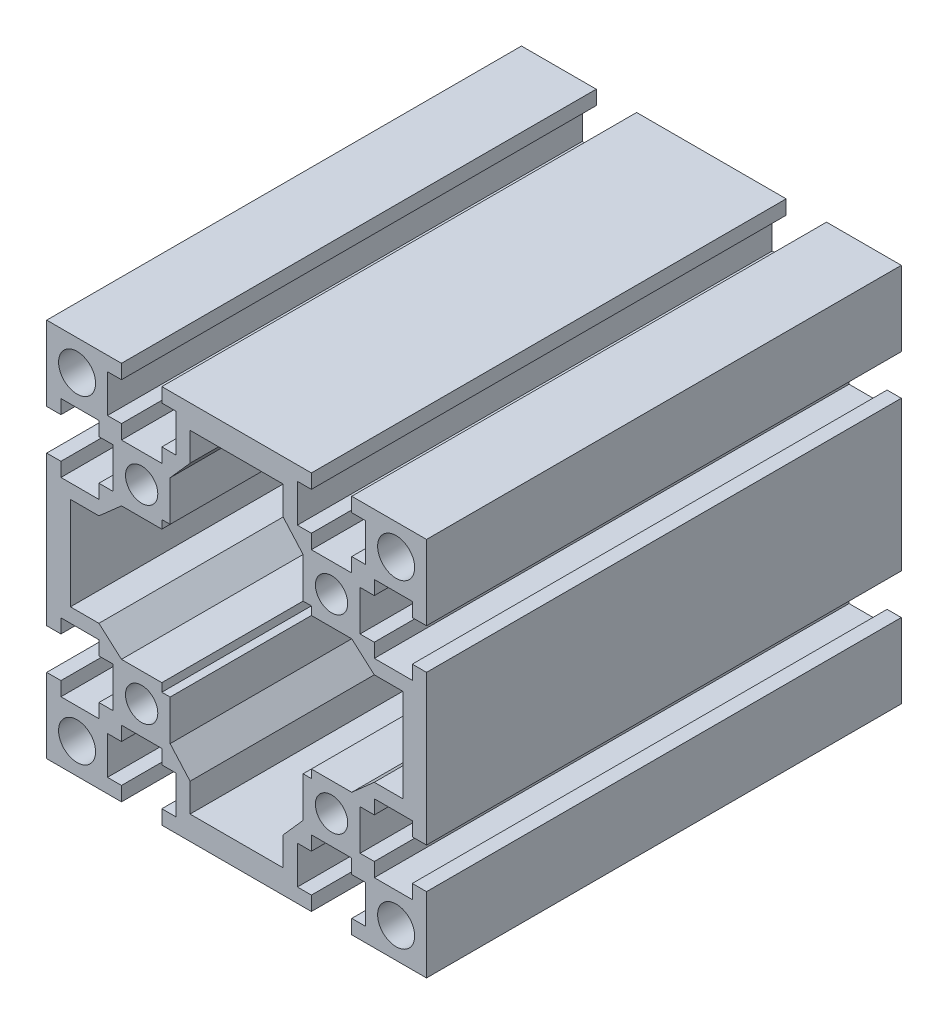
from build123d import *

# Parameters (mm, degrees)
SKETCH_1_R      = 3.9
SKETCH_1_R_2    = 3.4
EXTRUDE_1_DEPTH = 100


with BuildPart() as part:
    # 草图1 → 凸台-拉伸1 (new body)
    with BuildSketch(Plane.XY):
        Polygon((-23.218782805, 39.545792426), (-38.968782805, 39.545792426), (-38.968782805, 23.795792426), (-35.968782805, 23.795792426), (-35.968782805, 26.745792426), (-27.968782805, 26.745792426), (-27.968782805, 23.795792426), (-24.968782805, 23.795792426), (-24.968782805, 15.295792426), (-27.968782805, 15.295792426), (-27.968782805, 12.345792426), (-35.968782805, 12.345792426), (-35.968782805, 15.295792426), (-38.968782805, 15.295792426), (-38.968782805, -0.454207574), (-38.968782805, -16.204207574), (-35.968782805, -16.204207574), (-35.968782805, -13.254207574), (-27.968782805, -13.254207574), (-27.968782805, -16.204207574), (-24.968782805, -16.204207574), (-24.968782805, -24.704207574), (-27.968782805, -24.704207574), (-27.968782805, -27.654207574), (-35.968782805, -27.654207574), (-35.968782805, -24.704207574), (-38.968782805, -24.704207574), (-38.968782805, -40.454207574), (-23.218782805, -40.454207574), (-23.218782805, -37.454207574), (-26.168782805, -37.454207574), (-26.168782805, -29.454207574), (-23.218782805, -29.454207574), (-23.218782805, -26.454207574), (-14.718782805, -26.454207574), (-14.718782805, -29.454207574), (-11.768782805, -29.454207574), (-11.768782805, -37.454207574), (-14.718782805, -37.454207574), (-14.718782805, -40.454207574), (1.031217195, -40.454207574), (16.781217195, -40.454207574), (16.781217195, -37.454207574), (13.831217195, -37.454207574), (13.831217195, -29.454207574), (16.781217195, -29.454207574), (16.781217195, -26.454207574), (25.281217195, -26.454207574), (25.281217195, -29.454207574), (28.231217195, -29.454207574), (28.231217195, -37.454207574), (25.281217195, -37.454207574), (25.281217195, -40.454207574), (41.031217195, -40.454207574), (41.031217195, -24.704207574), (38.031217195, -24.704207574), (38.031217195, -27.654207574), (30.031217195, -27.654207574), (30.031217195, -24.704207574), (27.031217195, -24.704207574), (27.031217195, -16.204207574), (30.031217195, -16.204207574), (30.031217195, -13.254207574), (38.031217195, -13.254207574), (38.031217195, -16.204207574), (41.031217195, -16.204207574), (41.031217195, -0.454207574), (41.031217195, 15.295792426), (38.031217195, 15.295792426), (38.031217195, 12.345792426), (30.031217195, 12.345792426), (30.031217195, 15.295792426), (27.031217195, 15.295792426), (27.031217195, 23.795792426), (30.031217195, 23.795792426), (30.031217195, 26.745792426), (38.031217195, 26.745792426), (38.031217195, 23.795792426), (41.031217195, 23.795792426), (41.031217195, 39.545792426), (25.281217195, 39.545792426), (25.281217195, 36.545792426), (28.231217195, 36.545792426), (28.231217195, 28.545792426), (25.281217195, 28.545792426), (25.281217195, 25.545792426), (16.781217195, 25.545792426), (16.781217195, 28.545792426), (13.831217195, 28.545792426), (13.831217195, 36.545792426), (16.781217195, 36.545792426), (16.781217195, 39.545792426), (1.031217195, 39.545792426), (-14.718782805, 39.545792426), (-14.718782805, 36.545792426), (-11.768782805, 36.545792426), (-11.768782805, 28.545792426), (-14.718782805, 28.545792426), (-14.718782805, 25.545792426), (-23.218782805, 25.545792426), (-23.218782805, 28.545792426), (-26.168782805, 28.545792426), (-26.168782805, 36.545792426), (-23.218782805, 36.545792426), align=None)
        with Locations((-32.568782805, 33.145792426)):
            Circle(SKETCH_1_R, mode=Mode.SUBTRACT)
        with Locations((-18.968782805, 19.545792426)):
            Circle(SKETCH_1_R_2, mode=Mode.SUBTRACT)
        with Locations((34.631217195, 33.145792426)):
            Circle(SKETCH_1_R, mode=Mode.SUBTRACT)
        with Locations((21.031217195, 19.545792426)):
            Circle(SKETCH_1_R_2, mode=Mode.SUBTRACT)
        with Locations((-32.568782805, -34.054207574)):
            Circle(SKETCH_1_R, mode=Mode.SUBTRACT)
        with Locations((-18.968782805, -20.454207574)):
            Circle(SKETCH_1_R_2, mode=Mode.SUBTRACT)
        with Locations((34.631217195, -34.054207574)):
            Circle(SKETCH_1_R, mode=Mode.SUBTRACT)
        with Locations((21.031217195, -20.454207574)):
            Circle(SKETCH_1_R_2, mode=Mode.SUBTRACT)
        Polygon((-23.218782805, 13.545792426), (-14.718782805, 13.545792426), (-14.718782805, 15.295792426), (-12.968782805, 15.295792426), (-12.968782805, 23.795792426), (-8.768782805, 28.545792426), (-8.768782805, 34.545792426), (10.831217195, 34.545792426), (10.831217195, 28.545792426), (15.031217195, 23.795792426), (15.031217195, 15.295792426), (16.781217195, 15.295792426), (16.781217195, 13.545792426), (25.281217195, 13.545792426), (30.031217195, 9.345792426), (36.031217195, 9.345792426), (36.031217195, -10.254207574), (30.031217195, -10.254207574), (25.281217195, -14.454207574), (16.781217195, -14.454207574), (16.781217195, -16.204207574), (15.031217195, -16.204207574), (15.031217195, -24.704207574), (10.831217195, -29.454207574), (10.831217195, -35.454207574), (-8.768782805, -35.454207574), (-8.768782805, -29.454207574), (-12.968782805, -24.704207574), (-12.968782805, -16.204207574), (-14.718782805, -16.204207574), (-14.718782805, -14.454207574), (-23.218782805, -14.454207574), (-27.968782805, -10.254207574), (-33.968782805, -10.254207574), (-33.968782805, 9.345792426), (-27.968782805, 9.345792426), align=None, mode=Mode.SUBTRACT)
    extrude(amount=EXTRUDE_1_DEPTH)


solid = part.part
